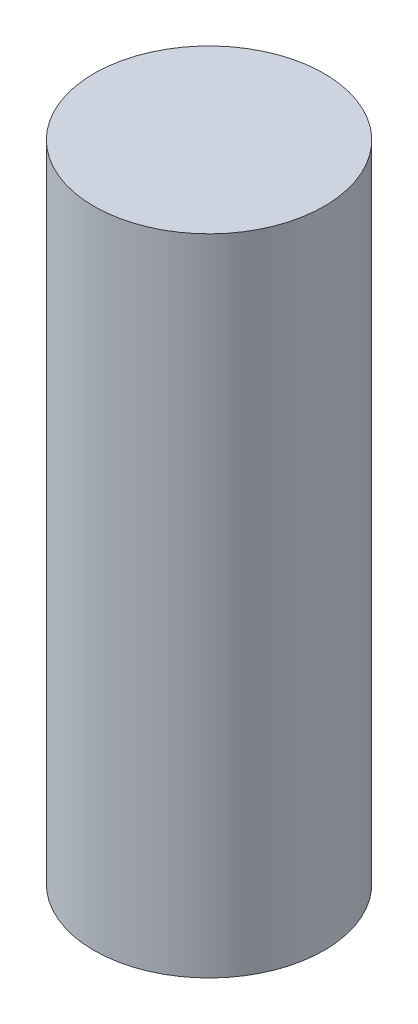
from build123d import *

# Parameters (mm, degrees)
BOSS_EXTRUDE1_DEPTH      = 14
BOSS_EXTRUDE1_DEPTH_BACK = 14
SKETCH1_R                = 5


with BuildPart() as part:
    # Sketch1 → Boss-Extrude1 (new, two sides: drawn at the far end of the back side and taken through both)
    with BuildSketch(Plane(origin=(0, 0, 0), x_dir=(1, 0, 0), z_dir=(0, 1, 0)).offset(-BOSS_EXTRUDE1_DEPTH_BACK)):
        Circle(SKETCH1_R)
    extrude(amount=BOSS_EXTRUDE1_DEPTH + BOSS_EXTRUDE1_DEPTH_BACK)


solid = part.part
